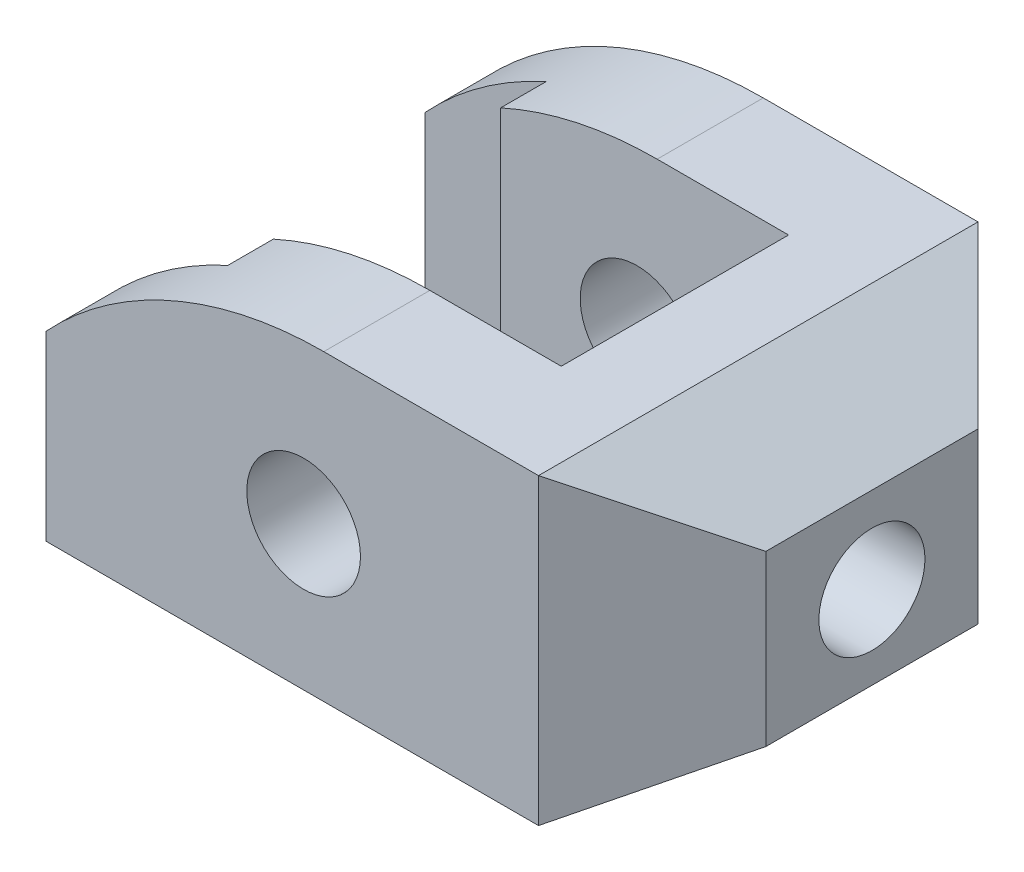
from build123d import *

# Parameters (mm, degrees)
BOSS_EXTRUDE1_DEPTH = 58
SKETCH3_R           = 7.5
CUT_EXTRUDE1_DEPTH  = 107.60206377
CUT_EXTRUDE2_DEPTH  = 107.60206377
CUT_EXTRUDE3_DEPTH  = 107.60206377
SKETCH6_R           = 7
CUT_EXTRUDE4_DEPTH  = 107.60206377


with BuildPart() as part:
    # Sketch2 → Boss-Extrude1 (new body)
    with BuildSketch(Plane.XY):
        with BuildLine():
            Line((0, 0), (65, 0))
            Line((65, 0), (80, 9.029262631))
            Line((80, 9.029262631), (80, 31.339745962))
            Line((80, 31.339745962), (65, 40))
            Line((65, 40), (36.66060556, 40))
            ThreePointArc((36.66060556, 40), (16.66060556, 35.82575695), (0, 24))
            Line((0, 24), (0, 0))
        make_face()
    extrude(amount=-BOSS_EXTRUDE1_DEPTH)

    # Sketch3 → Cut-Extrude1 (cut, through all)
    with BuildSketch(Plane.XY):
        with Locations((34, 19)):
            Circle(SKETCH3_R)
    extrude(amount=-CUT_EXTRUDE1_DEPTH, mode=Mode.SUBTRACT)

    # Sketch4 → Cut-Extrude2 (cut, through all)
    with BuildSketch(Plane(origin=(0, 0, 0), x_dir=(1, 0, 0), z_dir=(0, 1, 0))):
        Polygon((65, 58), (80, 43), (80, 58), align=None)
        Polygon((80, 0), (80, 15), (65, 0), align=None)
    extrude(amount=CUT_EXTRUDE2_DEPTH, mode=Mode.SUBTRACT)

    # Sketch5 → Cut-Extrude3 (cut, through all)
    with BuildSketch(Plane.XZ):
        Polygon((0, -8), (0, -50), (16, -50), (16, -44), (54, -44), (54, -14), (16, -14), (16, -8), align=None)
    extrude(amount=-CUT_EXTRUDE3_DEPTH, mode=Mode.SUBTRACT)

    # Sketch6 → Cut-Extrude4 (cut, through all)
    with BuildSketch(Plane(origin=(80, 0, 0), x_dir=(0, 0, -1), z_dir=(1, 0, 0))):
        with Locations((29, 20)):
            Circle(SKETCH6_R)
    extrude(amount=-CUT_EXTRUDE4_DEPTH, mode=Mode.SUBTRACT)


solid = part.part
